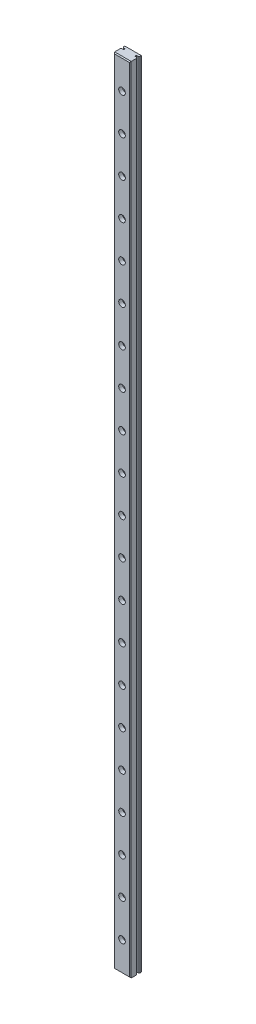
from build123d import *

# Parameters (mm, degrees)
CROQUIS1_W              = 9
CROQUIS1_H              = 6.5
SALIENTE_EXTRUIR1_DEPTH = 431
CROQUIS2_W              = 1.5
CROQUIS2_H              = 0.75
CORTAR_EXTRUIR1_DEPTH   = 431
CHAFL_N2_SIZE           = 0.5
CROQUIS3_R              = 1.8
CORTAR_EXTRUIR2_DEPTH   = 440
CHAFL_N4_SIZE           = 0.5
CROQUIS4_R              = 2.85
CORTAR_EXTRUIR3_DEPTH   = 4.4


with BuildPart() as part:
    # Croquis1 → Saliente-Extruir1 (new body)
    with BuildSketch(Plane(origin=(0, 0, 0), x_dir=(1, 0, 0), z_dir=(0, 1, 0))):
        with Locations((4.5, 3.25)):
            Rectangle(CROQUIS1_W, CROQUIS1_H)
    extrude(amount=SALIENTE_EXTRUIR1_DEPTH)

    # Croquis2 → Cortar-Extruir1 (cut)
    with BuildSketch(Plane(origin=(0, 431, 0), x_dir=(1, 0, 0), z_dir=(0, 1, 0))):
        with Locations((0.75, 4.375)):
            Rectangle(CROQUIS2_W, CROQUIS2_H)
        with Locations((8.25, 4.375)):
            Rectangle(CROQUIS2_W, CROQUIS2_H)
    extrude(amount=-CORTAR_EXTRUIR1_DEPTH, mode=Mode.SUBTRACT)

    # Chaflán2
    chafl_n2_edges = [part.edges().sort_by_distance(p)[0] for p in [
        (0, 215.5, -4.75),
        (0, 215.5, -4),
        (9, 215.5, -4.75),
        (9, 215.5, -4),
    ]]
    chamfer(chafl_n2_edges, length=CHAFL_N2_SIZE)

    # Croquis3 → Cortar-Extruir2 (cut)
    with BuildSketch(Plane.XY):
        with Locations((4.5, 415)):
            Circle(CROQUIS3_R)
        with Locations((4.5, 395)):
            Circle(CROQUIS3_R)
        with Locations((4.5, 375.052631579)):
            Circle(CROQUIS3_R)
        with Locations((4.5, 355.105263158)):
            Circle(CROQUIS3_R)
        with Locations((4.5, 335.157894737)):
            Circle(CROQUIS3_R)
        with Locations((4.5, 315.210526316)):
            Circle(CROQUIS3_R)
        with Locations((4.5, 295.263157895)):
            Circle(CROQUIS3_R)
        with Locations((4.5, 275.315789474)):
            Circle(CROQUIS3_R)
        with Locations((4.5, 255.368421053)):
            Circle(CROQUIS3_R)
        with Locations((4.5, 235.421052632)):
            Circle(CROQUIS3_R)
        with Locations((4.5, 215.473684211)):
            Circle(CROQUIS3_R)
        with Locations((4.5, 195.526315789)):
            Circle(CROQUIS3_R)
        with Locations((4.5, 175.578947368)):
            Circle(CROQUIS3_R)
        with Locations((4.5, 155.631578947)):
            Circle(CROQUIS3_R)
        with Locations((4.5, 135.684210526)):
            Circle(CROQUIS3_R)
        with Locations((4.5, 115.736842105)):
            Circle(CROQUIS3_R)
        with Locations((4.5, 95.789473684)):
            Circle(CROQUIS3_R)
        with Locations((4.5, 75.842105263)):
            Circle(CROQUIS3_R)
        with Locations((4.5, 55.894736842)):
            Circle(CROQUIS3_R)
        with Locations((4.5, 35.947368421)):
            Circle(CROQUIS3_R)
        with Locations((4.5, 16)):
            Circle(CROQUIS3_R)
    extrude(amount=-CORTAR_EXTRUIR2_DEPTH, mode=Mode.SUBTRACT)

    # Chaflán4
    chafl_n4_edges = [part.edges().sort_by_distance(p)[0] for p in [
        (4.5, 431, -6.5),
        (4.5, 0, -6.5),
        (4.5, 0, 0),
        (4.5, 431, 0),
        (0, 215.5, -6.5),
        (9, 215.5, -6.5),
        (9, 215.5, 0),
        (0, 215.5, 0),
    ]]
    chamfer(chafl_n4_edges, length=CHAFL_N4_SIZE)

    # Croquis4 → Cortar-Extruir3 (cut)
    with BuildSketch(Plane(origin=(0, 0, -6.5), x_dir=(-1, 0, 0), z_dir=(0, 0, -1))):
        with Locations((-4.5, 415)):
            Circle(CROQUIS4_R)
        with Locations((-4.5, 395.05)):
            Circle(CROQUIS4_R)
        with Locations((-4.5, 375.1)):
            Circle(CROQUIS4_R)
        with Locations((-4.5, 355.15)):
            Circle(CROQUIS4_R)
        with Locations((-4.5, 335.2)):
            Circle(CROQUIS4_R)
        with Locations((-4.5, 315.25)):
            Circle(CROQUIS4_R)
        with Locations((-4.5, 295.3)):
            Circle(CROQUIS4_R)
        with Locations((-4.5, 275.35)):
            Circle(CROQUIS4_R)
        with Locations((-4.5, 255.4)):
            Circle(CROQUIS4_R)
        with Locations((-4.5, 235.45)):
            Circle(CROQUIS4_R)
        with Locations((-4.5, 215.5)):
            Circle(CROQUIS4_R)
        with Locations((-4.5, 195.55)):
            Circle(CROQUIS4_R)
        with Locations((-4.5, 175.6)):
            Circle(CROQUIS4_R)
        with Locations((-4.5, 155.65)):
            Circle(CROQUIS4_R)
        with Locations((-4.5, 135.7)):
            Circle(CROQUIS4_R)
        with Locations((-4.5, 115.75)):
            Circle(CROQUIS4_R)
        with Locations((-4.5, 95.8)):
            Circle(CROQUIS4_R)
        with Locations((-4.5, 75.85)):
            Circle(CROQUIS4_R)
        with Locations((-4.5, 55.9)):
            Circle(CROQUIS4_R)
        with Locations((-4.5, 35.95)):
            Circle(CROQUIS4_R)
        with Locations((-4.5, 16)):
            Circle(CROQUIS4_R)
    extrude(amount=-CORTAR_EXTRUIR3_DEPTH, mode=Mode.SUBTRACT)


solid = part.part
